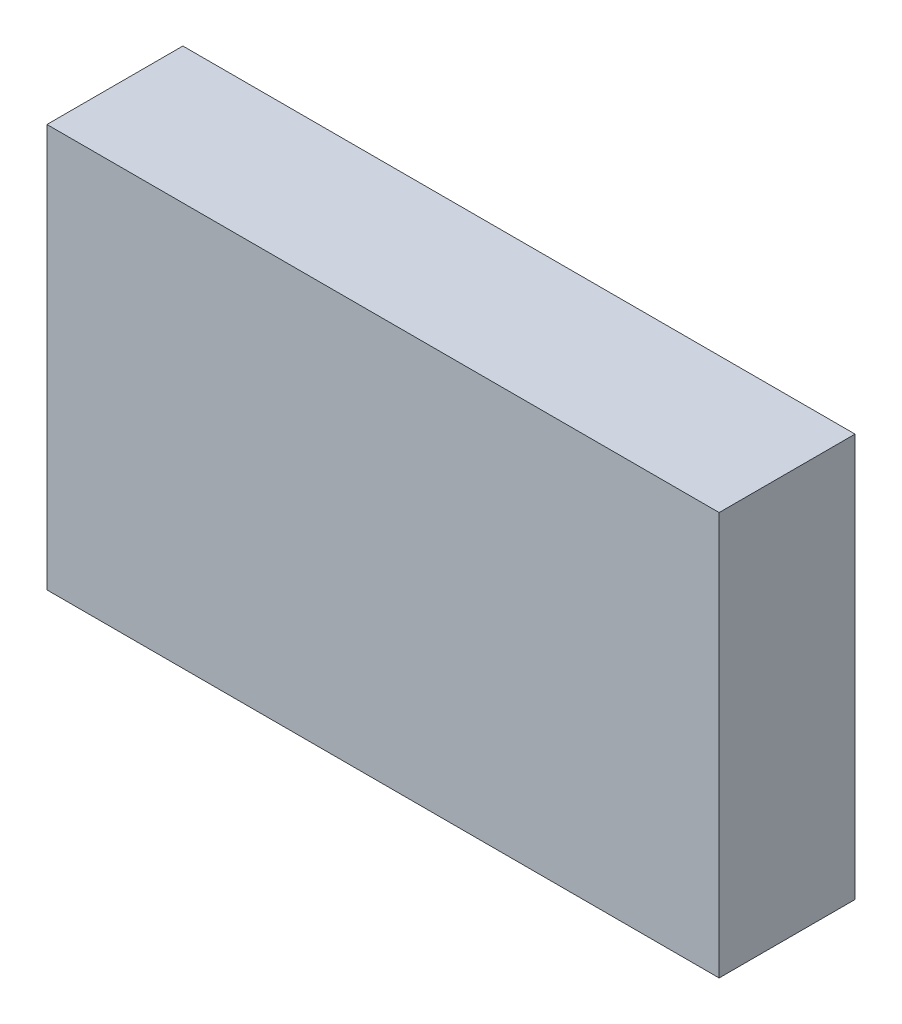
from build123d import *

# Parameters (mm, degrees)
SKETCH1_W               = 4.946
SKETCH1_H               = 2.966
COMPONENT_OUTLINE_DEPTH = 1


with BuildPart() as part:
    # Sketch1 → Component_Outline (new body)
    with BuildSketch(Plane.XY):
        Rectangle(SKETCH1_W, SKETCH1_H)
    extrude(amount=COMPONENT_OUTLINE_DEPTH)


solid = part.part
